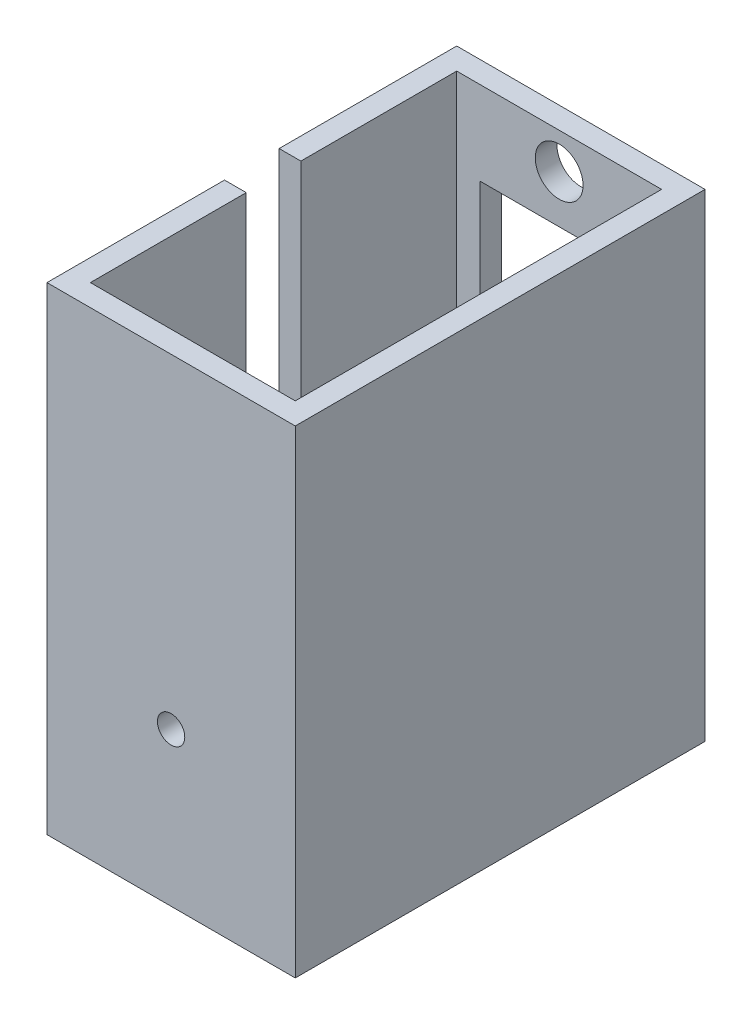
from build123d import *

# Parameters (mm, degrees)
BOSS_EXTRUDE1_DEPTH = 35
SKETCH2_R           = 1.75
SKETCH2_W           = 11.6
SKETCH2_H           = 22.75
CUT_EXTRUDE1_DEPTH  = 1.59
SKETCH4_R           = 1.25
CUT_EXTRUDE3_DEPTH  = 4
SKETCH5_R           = 1
CUT_EXTRUDE4_DEPTH  = 4


with BuildPart() as part:
    # Sketch1 → Boss-Extrude1 (new body)
    with BuildSketch(Plane(origin=(0, 0, 0), x_dir=(1, 0, 0), z_dir=(0, 1, 0))):
        Polygon((0, -13), (1.59, -13), (1.59, -1.59), (16.59, -1.59), (16.59, -28.41), (1.59, -28.41), (1.59, -17), (0, -17), (0, -30), (18.18, -30), (18.18, 0), (0, 0), align=None)
    extrude(amount=BOSS_EXTRUDE1_DEPTH)

    # Sketch2 → Cut-Extrude1 (cut)
    with BuildSketch(Plane(origin=(0, 0, 0), x_dir=(-1, 0, 0), z_dir=(0, 0, -1))):
        with Locations((-9.09, 32.375)):
            Circle(SKETCH2_R)
        with Locations((-9.09, 2.625)):
            Circle(SKETCH2_R)
        with Locations((-9.09, 17.5)):
            Rectangle(SKETCH2_W, SKETCH2_H)
    extrude(amount=-CUT_EXTRUDE1_DEPTH, mode=Mode.SUBTRACT)

    # Sketch4 → Cut-Extrude3 (cut)
    with BuildSketch(Plane.ZY):
        with Locations((6.5, 11.22)):
            Circle(SKETCH4_R)
        with Locations((23.5, 11.22)):
            Circle(SKETCH4_R)
    extrude(amount=-CUT_EXTRUDE3_DEPTH, mode=Mode.SUBTRACT)

    # Sketch5 → Cut-Extrude4 (cut)
    with BuildSketch(Plane.XY.offset(30)):
        with Locations((9.09, 11.22)):
            Circle(SKETCH5_R)
    extrude(amount=-CUT_EXTRUDE4_DEPTH, mode=Mode.SUBTRACT)


solid = part.part
